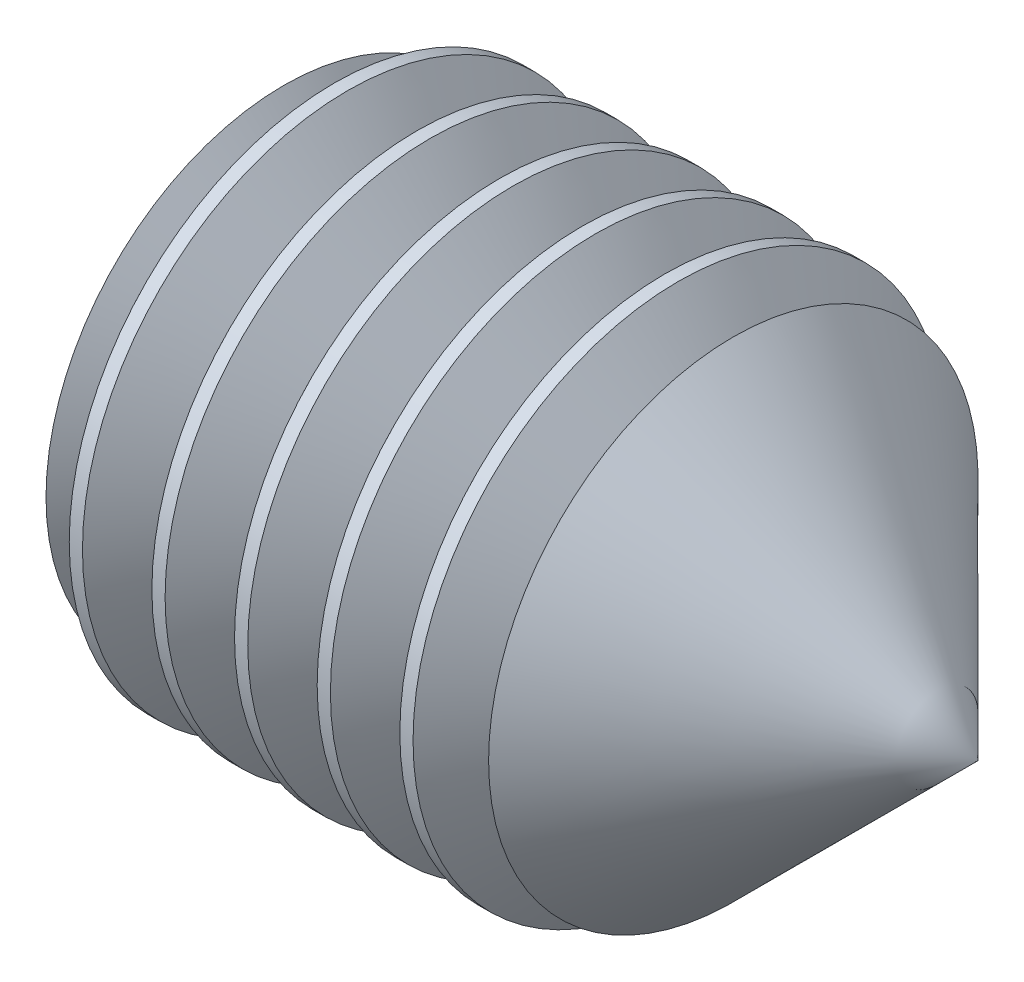
from build123d import *

# Parameters (mm, degrees)
HEX_2_DEPTH     = 2
THDSCHPAT_COUNT = 6
THDSCHPAT_PITCH = 0.467610841


with BuildPart() as part:
    # BodySke → BaseBody (revolve)
    with BuildSketch(Plane.XY, mode=Mode.PRIVATE) as basebody_sk:
        Polygon((0, 0), (0, 1.2195), (0.161946751, 1.5), (2.5, 1.5), (4, 0), align=None)
    revolve(basebody_sk.sketch.rotate(Axis((-12.7, 0, 0), (1, 0, 0)), 90), axis=Axis((-12.7, 0, 0), (1, 0, 0)))

    # Sketch2 → Hex 2 (cut)
    with BuildSketch(Plane.ZY):
        Polygon((0.433012702, 0.75), (-0.433012702, 0.75), (-0.866025404, 0), (-0.433012702, -0.75), (0.433012702, -0.75), (0.866025404, 0), align=None)
    extrude(amount=-HEX_2_DEPTH, mode=Mode.SUBTRACT)

    # ThdSchSke → ThreadSchematic (revolve, cut)
    with BuildSketch(Plane.XY):
        Polygon((0.161946751, -1.2195), (-0.034461464, -1.5), (-0.034461464, -1.875), (0.358354965, -1.875), (0.358354965, -1.5), align=None)
    threadschematic = revolve(axis=Axis((-3.175, 0, 0), (1, 0, 0)), mode=Mode.SUBTRACT)

    # ThdSchPat: ThreadSchematic ×6
    with Locations(*[(i * THDSCHPAT_PITCH, 0, 0) for i in range(1, THDSCHPAT_COUNT)]):
        add(threadschematic, mode=Mode.SUBTRACT)


solid = part.part
